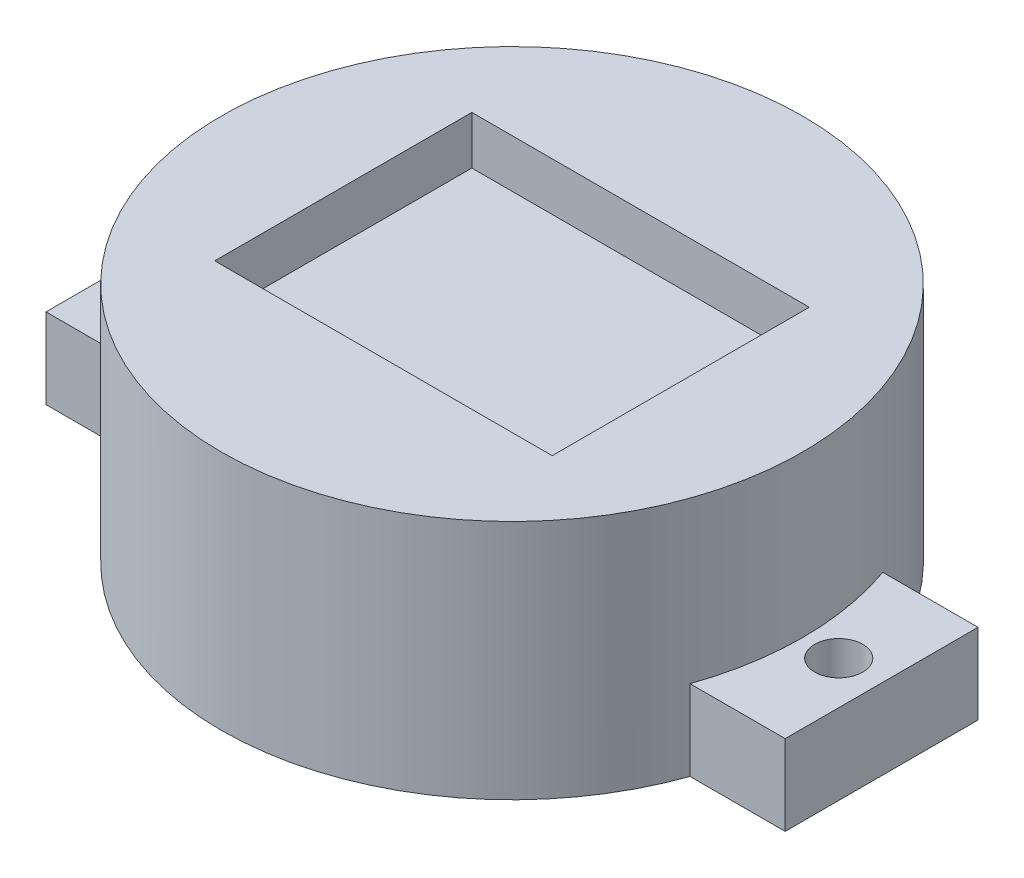
from build123d import *

# Parameters (mm, degrees)
CROQUIS2_W              = 21
CROQUIS2_H              = 16
CORTAR_EXTRUIR1_DEPTH   = 3
CROQUIS4_W              = 8
CROQUIS4_H              = 12
CROQUIS4_R              = 1.5
SALIENTE_EXTRUIR1_DEPTH = 5


with BuildPart() as part:
    # Croquis1 → Revolución1 (revolve)
    with BuildSketch(Plane.XY, mode=Mode.PRIVATE) as revoluci_n1_sk:
        Polygon((-18.1, 9), (-18.1, -6), (-13.1, -6), (-13.1, 0), (0, 0), (0, 9), align=None)
    revolve(revoluci_n1_sk.sketch.rotate(Axis((0, 25.323006639, 0), (0, -1, 0)), 270), axis=Axis((0, 25.323006639, 0), (0, -1, 0)))

    # Croquis2 → Cortar-Extruir1 (cut)
    with BuildSketch(Plane(origin=(0, 9, 0), x_dir=(1, 0, 0), z_dir=(0, 1, 0))):
        Rectangle(CROQUIS2_W, CROQUIS2_H)
    extrude(amount=-CORTAR_EXTRUIR1_DEPTH, mode=Mode.SUBTRACT)

    # Croquis4 → Saliente-Extruir1 (add)
    # profile 1 of 2: a face of its own
    with BuildSketch(Plane.XZ.offset(6)):
        with Locations((-19, 0)):
            Rectangle(CROQUIS4_W, CROQUIS4_H)
        with Locations(Location((-20.333333333, 0, 0), (0, 0, 270))):
            Circle(CROQUIS4_R, mode=Mode.SUBTRACT)
    # profile 2 of 2: a face of its own
    with BuildSketch(Plane.XZ.offset(6)):
        with Locations((19, 0)):
            Rectangle(CROQUIS4_W, CROQUIS4_H)
        with Locations(Location((20.333333333, 0, 0), (0, 0, 90))):
            Circle(CROQUIS4_R, mode=Mode.SUBTRACT)
    extrude(amount=-SALIENTE_EXTRUIR1_DEPTH)


solid = part.part
